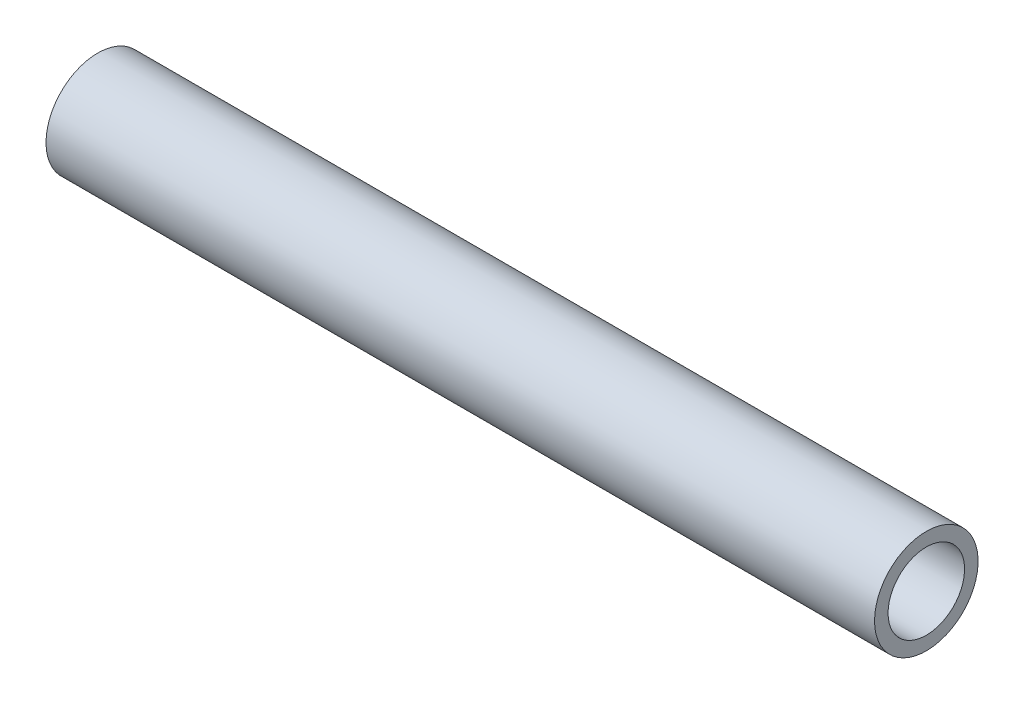
from build123d import *

# Parameters (mm, degrees)
SKETCH4_R           = 4.7625
SKETCH4_R_2         = 3.5179
BOSS_EXTRUDE1_DEPTH = 38.1


with BuildPart() as part:
    # Sketch4 → Boss-Extrude1 (new, symmetric)
    with BuildSketch(Plane(origin=(0, 0, 0), x_dir=(0, 0, -1), z_dir=(1, 0, 0))):
        Circle(SKETCH4_R)
        Circle(SKETCH4_R_2, mode=Mode.SUBTRACT)
    extrude(amount=BOSS_EXTRUDE1_DEPTH, both=True)


solid = part.part
